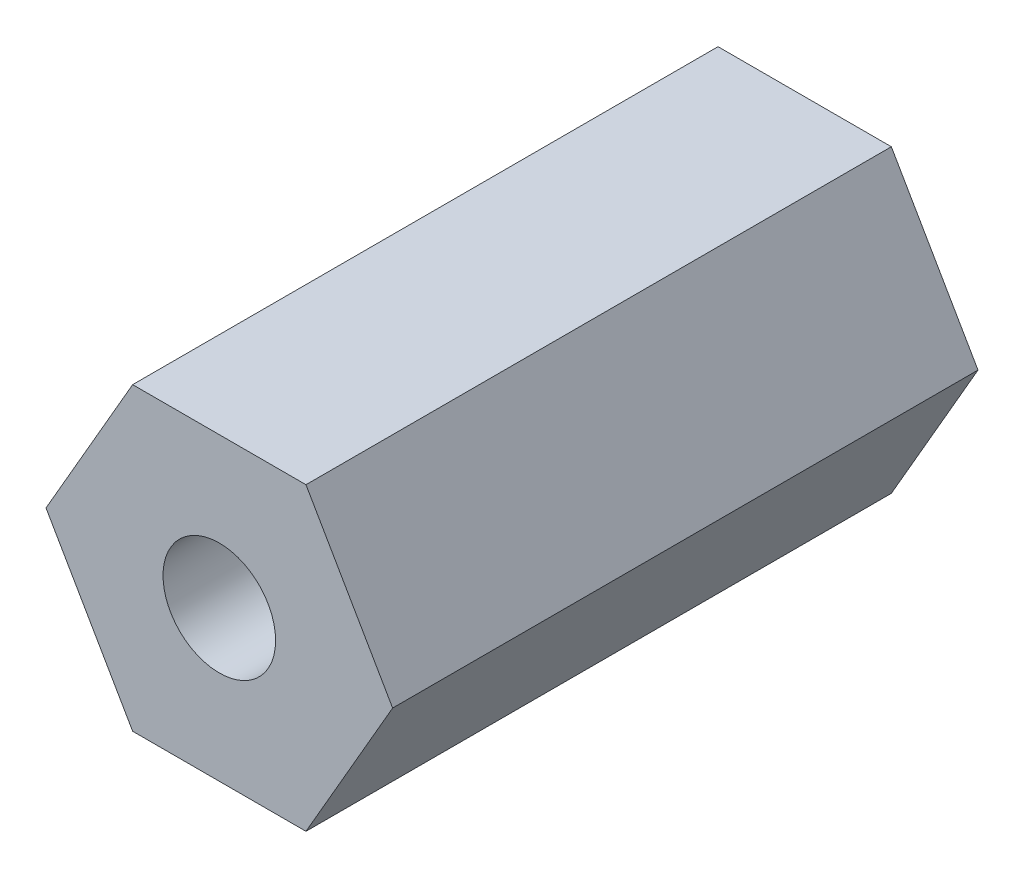
from build123d import *

# Parameters (mm, degrees)
SKETCH_1_R      = 1.5
EXTRUDE_1_DEPTH = 15.6


with BuildPart() as part:
    # 草图1 → 凸台-拉伸1 (new body)
    with BuildSketch(Plane.XY):
        Polygon((2.309401077, 4), (-2.309401077, 4), (-4.618802154, 0), (-2.309401077, -4), (2.309401077, -4), (4.618802154, 0), align=None)
        Circle(SKETCH_1_R, mode=Mode.SUBTRACT)
    extrude(amount=EXTRUDE_1_DEPTH)


solid = part.part
